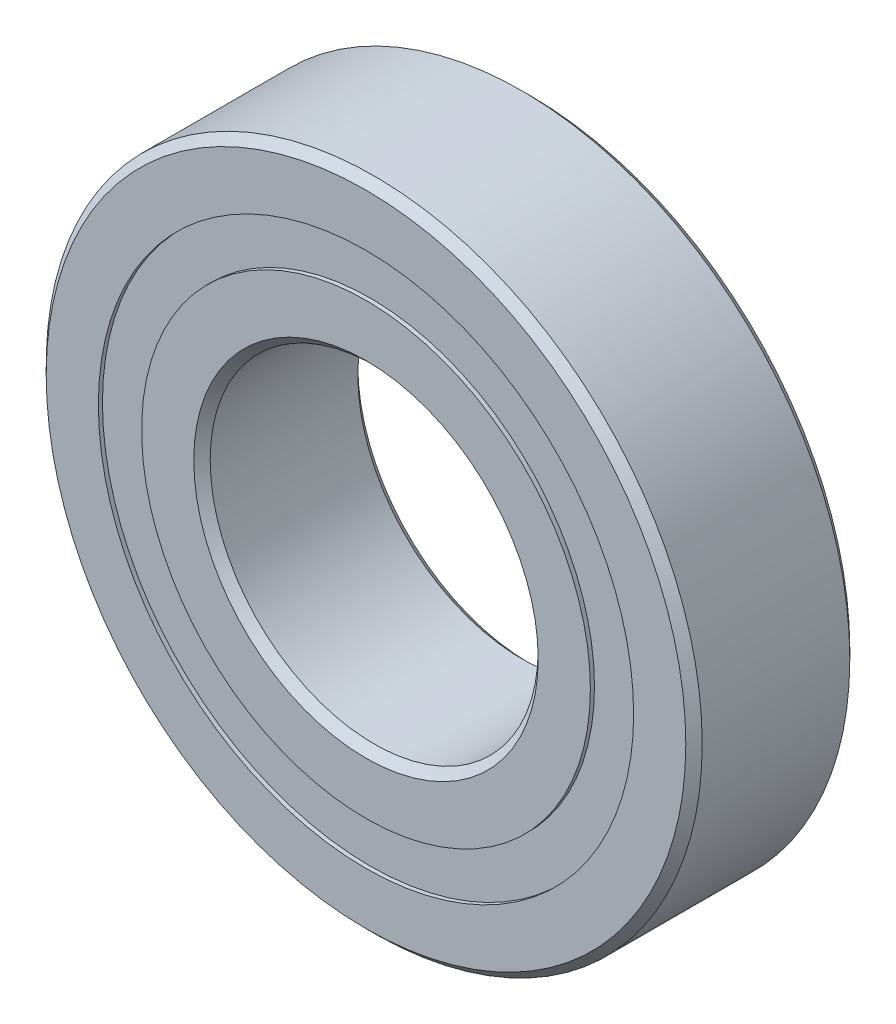
from build123d import *

# Parameters (mm, degrees)
CIRPATTERN1_COUNT = 12
SKETCH5_W         = 2.750786573
SKETCH5_H         = 3.34945055


with BuildPart() as part:
    # Sketch1 → Revolve1 (revolve)
    with BuildSketch(Plane(origin=(0, 0, 0), x_dir=(0, 0, -1), z_dir=(1, 0, 0))):
        with BuildLine():
            Line((5.715, 25.4), (-5.715, 25.4))
            Line((-5.715, 25.4), (-6.35, 24.765))
            Line((-6.35, 24.765), (-6.35, 20.724725275))
            Line((-6.35, 20.724725275), (-2.822222222, 20.724725275))
            ThreePointArc((-2.822222222, 20.724725275), (0, 22.331713427), (2.822222222, 20.724725275))
            Line((2.822222222, 20.724725275), (6.35, 20.724725275))
            Line((6.35, 20.724725275), (6.35, 24.765))
            Line((6.35, 24.765), (5.715, 25.4))
        make_face()
    revolve(axis=Axis((0, 0, 6.35), (0, 0, -1)))


with BuildPart() as body_2:
    # Sketch3 → Revolve3 (revolve)
    with BuildSketch(Plane(origin=(0, 0, 0), x_dir=(0, 0, -1), z_dir=(1, 0, 0))):
        with BuildLine():
            Line((-6.35, 17.375274725), (-2.822222222, 17.375274725))
            ThreePointArc((-2.822222222, 17.375274725), (0, 15.768286573), (2.822222222, 17.375274725))
            Line((2.822222222, 17.375274725), (6.35, 17.375274725))
            Line((6.35, 17.375274725), (6.35, 13.335))
            Line((6.35, 13.335), (5.715, 12.7))
            Line((5.715, 12.7), (-5.715, 12.7))
            Line((-5.715, 12.7), (-6.35, 13.335))
            Line((-6.35, 13.335), (-6.35, 17.375274725))
        make_face()
    revolve(axis=Axis((0, 0, 6.35), (0, 0, -1)))


with BuildPart() as body_3:
    # Sketch4 → Revolve4 (revolve)
    with BuildSketch(Plane(origin=(0, 0, 0), x_dir=(0, 0, -1), z_dir=(1, 0, 0))):
        with BuildLine():
            Line((-3.281713427, 19.05), (3.281713427, 19.05))
            ThreePointArc((3.281713427, 19.05), (0, 22.331713427), (-3.281713427, 19.05))
        make_face()
    revolve(axis=Axis((0, 19.05, 3.281713427), (0, 0, -1)))


with BuildPart() as cirpattern1_1:
    # CirPattern1: pattern copy
    add(body_3.part.rotate(Axis((0, 0, -6.35), (0, 0, 1)), 1 * 360 / CIRPATTERN1_COUNT))


with BuildPart() as cirpattern1_2:
    # CirPattern1: pattern copy
    add(body_3.part.rotate(Axis((0, 0, -6.35), (0, 0, 1)), 2 * 360 / CIRPATTERN1_COUNT))


with BuildPart() as cirpattern1_3:
    # CirPattern1: pattern copy
    add(body_3.part.rotate(Axis((0, 0, -6.35), (0, 0, 1)), 3 * 360 / CIRPATTERN1_COUNT))


with BuildPart() as cirpattern1_4:
    # CirPattern1: pattern copy
    add(body_3.part.rotate(Axis((0, 0, -6.35), (0, 0, 1)), 4 * 360 / CIRPATTERN1_COUNT))


with BuildPart() as cirpattern1_5:
    # CirPattern1: pattern copy
    add(body_3.part.rotate(Axis((0, 0, -6.35), (0, 0, 1)), 5 * 360 / CIRPATTERN1_COUNT))


with BuildPart() as cirpattern1_6:
    # CirPattern1: pattern copy
    add(body_3.part.rotate(Axis((0, 0, -6.35), (0, 0, 1)), 6 * 360 / CIRPATTERN1_COUNT))


with BuildPart() as cirpattern1_7:
    # CirPattern1: pattern copy
    add(body_3.part.rotate(Axis((0, 0, -6.35), (0, 0, 1)), 7 * 360 / CIRPATTERN1_COUNT))


with BuildPart() as cirpattern1_8:
    # CirPattern1: pattern copy
    add(body_3.part.rotate(Axis((0, 0, -6.35), (0, 0, 1)), 8 * 360 / CIRPATTERN1_COUNT))


with BuildPart() as cirpattern1_9:
    # CirPattern1: pattern copy
    add(body_3.part.rotate(Axis((0, 0, -6.35), (0, 0, 1)), 9 * 360 / CIRPATTERN1_COUNT))


with BuildPart() as cirpattern1_10:
    # CirPattern1: pattern copy
    add(body_3.part.rotate(Axis((0, 0, -6.35), (0, 0, 1)), 10 * 360 / CIRPATTERN1_COUNT))


with BuildPart() as cirpattern1_11:
    # CirPattern1: pattern copy
    add(body_3.part.rotate(Axis((0, 0, -6.35), (0, 0, 1)), 11 * 360 / CIRPATTERN1_COUNT))


with BuildPart() as body_15:
    # Sketch5 → Revolve5 (revolve)
    with BuildSketch(Plane(origin=(0, 0, 0), x_dir=(0, 0, -1), z_dir=(1, 0, 0))):
        with Locations((-4.657106714, 19.05)):
            Rectangle(SKETCH5_W, SKETCH5_H)
        with Locations((4.657106714, 19.05)):
            Rectangle(SKETCH5_W, SKETCH5_H)
    revolve(axis=Axis((0, 0, 6.35), (0, 0, -1)))


solid = Compound([part.part, body_2.part, body_3.part, cirpattern1_1.part, cirpattern1_2.part, cirpattern1_3.part, cirpattern1_4.part, cirpattern1_5.part, cirpattern1_6.part, cirpattern1_7.part, cirpattern1_8.part, cirpattern1_9.part, cirpattern1_10.part, cirpattern1_11.part, body_15.part])
